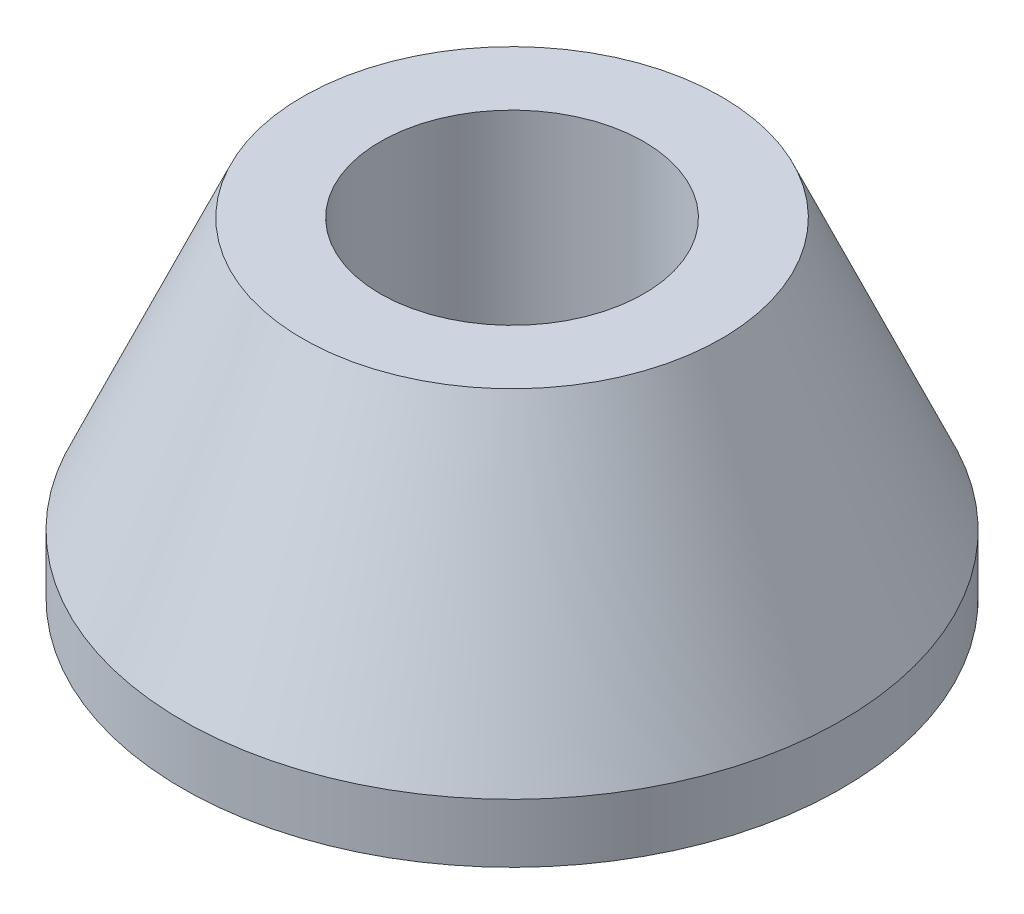
from build123d import *


with BuildPart() as part:
    # Sketch1 → Revolve1 (revolve)
    with BuildSketch(Plane.XY, mode=Mode.PRIVATE) as revolve1_sk:
        Polygon((-2.436194896, 2), (-2.436194896, 0), (-15, 0), (-15, 2.679814385), (-9.535962877, 15), (-6, 15), (-6, 2), align=None)
    revolve(revolve1_sk.sketch.rotate(Axis((0, 0, 0), (0, 1, 0)), 270), axis=Axis((0, 0, 0), (0, 1, 0)))


solid = part.part
